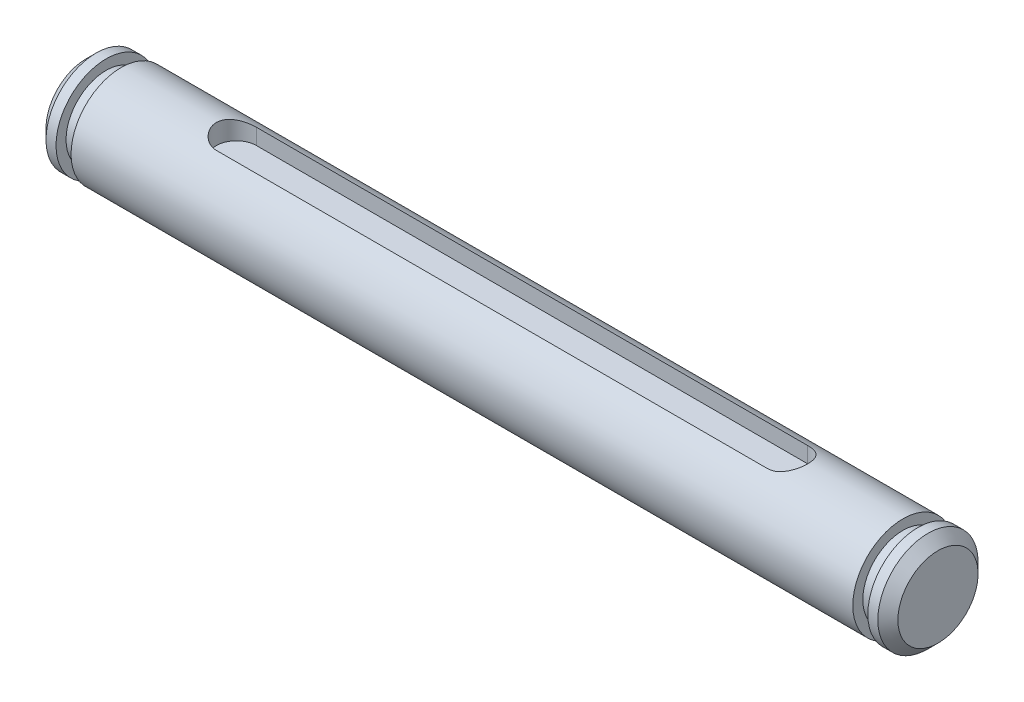
from build123d import *

# Parameters (mm, degrees)
CHAMFER1_SIZE      = 1
SKETCH3_W          = 4
SKETCH3_H          = 4
CUT_EXTRUDE1_DEPTH = 5
CUT_EXTRUDE2_DEPTH = 10


with BuildPart() as part:
    # Sketch1 → Revolve1 (revolve)
    with BuildSketch(Plane.XY, mode=Mode.PRIVATE) as revolve1_sk:
        Polygon((-42.5, 0), (-42.5, 5), (-40.5, 5), (-40.5, 4), (-39, 4), (-39, 5), (39, 5), (39, 4), (40.5, 4), (40.5, 5), (42.5, 5), (42.5, 0), align=None)
    revolve(revolve1_sk.sketch.rotate(Axis((-47.151991765, 0, 0), (1, 0, 0)), 90), axis=Axis((-47.151991765, 0, 0), (1, 0, 0)))

    # Chamfer1
    chamfer1_edges = [part.edges().sort_by_distance(p)[0] for p in [
        (42.5, 0, -5),
        (-42.5, 0, -5),
    ]]
    chamfer(chamfer1_edges, length=CHAMFER1_SIZE)

    # Sketch3 → Cut-Extrude1 (cut)
    with BuildSketch(Plane(origin=(0, 0, 0), x_dir=(0, 0, -1), z_dir=(1, 0, 0))):
        with Locations((0, 5)):
            Rectangle(SKETCH3_W, SKETCH3_H)
    extrude(amount=-CUT_EXTRUDE1_DEPTH, mode=Mode.SUBTRACT)

    # Sketch4 → Cut-Extrude2 (cut)
    with BuildSketch(Plane(origin=(0, 3, 0), x_dir=(1, 0, 0), z_dir=(0, 1, 0))):
        with BuildLine():
            Line((27.5, -2), (0, -2))
            Line((0, -2), (-27.5, -2))
            ThreePointArc((-27.5, -2), (-29.5, 0), (-27.5, 2))
            Line((-27.5, 2), (0, 2))
            Line((0, 2), (27.5, 2))
            ThreePointArc((27.5, 2), (29.5, 0), (27.5, -2))
        make_face()
    extrude(amount=CUT_EXTRUDE2_DEPTH, mode=Mode.SUBTRACT)


solid = part.part
